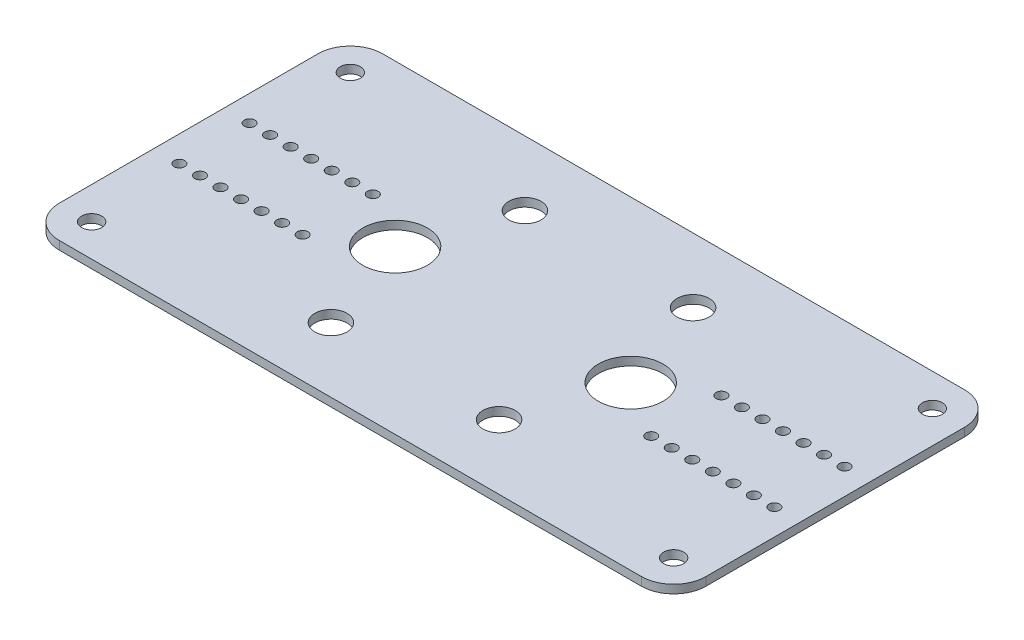
from build123d import *

# Parameters (mm, degrees)
SKETCH1_W               = 200
SKETCH1_H               = 100
BOSS_EXTRUDE1_DEPTH     = 2.6
FILLET1_R               = 10
SKETCH8_R               = 1.65
CUT_EXTRUDE4_DEPTH      = 2.6
LPATTERN1_COUNT         = 7
LPATTERN1_PITCH         = 6.35
MIRROR1_COPY_1_SKETCH_R = 1.65
MIRROR1_COPY_1_DEPTH    = 2.6
MIRROR1_COPY_2_SKETCH_R = 1.65
MIRROR1_COPY_2_DEPTH    = 2.6
MIRROR1_COPY_3_SKETCH_R = 1.65
MIRROR1_COPY_3_DEPTH    = 2.6
MIRROR1_COPY_4_SKETCH_R = 1.65
MIRROR1_COPY_4_DEPTH    = 2.6
MIRROR1_COPY_5_SKETCH_R = 1.65
MIRROR1_COPY_5_DEPTH    = 2.6
MIRROR1_COPY_6_SKETCH_R = 1.65
MIRROR1_COPY_6_DEPTH    = 2.6
SKETCH6_R               = 3.1
CUT_EXTRUDE6_DEPTH      = 2.6
MIRROR6_COPY_1_SKETCH_R = 3.1
MIRROR6_COPY_1_DEPTH    = 2.6
SKETCH13_R              = 4.980627928
CUT_EXTRUDE7_DEPTH      = 2.6
MIRROR8_COPY_1_SKETCH_R = 4.980627928
MIRROR8_COPY_1_DEPTH    = 2.6
SKETCH15_R              = 10
CUT_EXTRUDE8_DEPTH      = 2.6


with BuildPart() as part:
    # Sketch1 → Boss-Extrude1 (new body)
    with BuildSketch(Plane(origin=(0, 0, 0), x_dir=(1, 0, 0), z_dir=(0, 1, 0))):
        with Locations((100, -50)):
            Rectangle(SKETCH1_W, SKETCH1_H)
    extrude(amount=BOSS_EXTRUDE1_DEPTH)

    # Fillet1
    fillet1_edges = [part.edges().sort_by_distance(p)[0] for p in [
        (0, 1.3, 0),
        (200, 1.3, 0),
        (200, 1.3, 100),
        (0, 1.3, 100),
    ]]
    fillet(fillet1_edges, radius=FILLET1_R)

    # Sketch8 → Cut-Extrude4 (cut)
    with BuildSketch(Plane.XZ):
        with Locations(Location((192, 60.85, 0), (0, 0, 270))):
            Circle(SKETCH8_R)
        with Locations(Location((192, 39.15, 0), (0, 0, 270))):
            Circle(SKETCH8_R)
    cut_extrude4 = extrude(amount=-CUT_EXTRUDE4_DEPTH, mode=Mode.SUBTRACT)

    # LPattern1: Cut-Extrude4 ×7
    with Locations(*[(-i * LPATTERN1_PITCH, 0, 0) for i in range(1, LPATTERN1_COUNT)]):
        add(cut_extrude4, mode=Mode.SUBTRACT)

    # Mirror1: Cut-Extrude4 across plane
    add(cut_extrude4.mirror(Plane(origin=(100, 0, 0), x_dir=(0, 0, 1), z_dir=(1, 0, 0))), mode=Mode.SUBTRACT)

    # Mirror1 copy 1 sketch → Mirror1 copy 1 (cut)
    with BuildSketch(Plane(origin=(206.35, 0, 0), x_dir=(-1, 0, 0), z_dir=(0, -1, 0))):
        with Locations((192, -60.85)):
            Circle(MIRROR1_COPY_1_SKETCH_R)
        with Locations((192, -39.15)):
            Circle(MIRROR1_COPY_1_SKETCH_R)
    extrude(amount=-MIRROR1_COPY_1_DEPTH, mode=Mode.SUBTRACT)

    # Mirror1 copy 2 sketch → Mirror1 copy 2 (cut)
    with BuildSketch(Plane(origin=(212.7, 0, 0), x_dir=(-1, 0, 0), z_dir=(0, -1, 0))):
        with Locations((192, -60.85)):
            Circle(MIRROR1_COPY_2_SKETCH_R)
        with Locations((192, -39.15)):
            Circle(MIRROR1_COPY_2_SKETCH_R)
    extrude(amount=-MIRROR1_COPY_2_DEPTH, mode=Mode.SUBTRACT)

    # Mirror1 copy 3 sketch → Mirror1 copy 3 (cut)
    with BuildSketch(Plane(origin=(219.05, 0, 0), x_dir=(-1, 0, 0), z_dir=(0, -1, 0))):
        with Locations((192, -60.85)):
            Circle(MIRROR1_COPY_3_SKETCH_R)
        with Locations((192, -39.15)):
            Circle(MIRROR1_COPY_3_SKETCH_R)
    extrude(amount=-MIRROR1_COPY_3_DEPTH, mode=Mode.SUBTRACT)

    # Mirror1 copy 4 sketch → Mirror1 copy 4 (cut)
    with BuildSketch(Plane(origin=(225.4, 0, 0), x_dir=(-1, 0, 0), z_dir=(0, -1, 0))):
        with Locations((192, -60.85)):
            Circle(MIRROR1_COPY_4_SKETCH_R)
        with Locations((192, -39.15)):
            Circle(MIRROR1_COPY_4_SKETCH_R)
    extrude(amount=-MIRROR1_COPY_4_DEPTH, mode=Mode.SUBTRACT)

    # Mirror1 copy 5 sketch → Mirror1 copy 5 (cut)
    with BuildSketch(Plane(origin=(231.75, 0, 0), x_dir=(-1, 0, 0), z_dir=(0, -1, 0))):
        with Locations((192, -60.85)):
            Circle(MIRROR1_COPY_5_SKETCH_R)
        with Locations((192, -39.15)):
            Circle(MIRROR1_COPY_5_SKETCH_R)
    extrude(amount=-MIRROR1_COPY_5_DEPTH, mode=Mode.SUBTRACT)

    # Mirror1 copy 6 sketch → Mirror1 copy 6 (cut)
    with BuildSketch(Plane(origin=(238.1, 0, 0), x_dir=(-1, 0, 0), z_dir=(0, -1, 0))):
        with Locations((192, -60.85)):
            Circle(MIRROR1_COPY_6_SKETCH_R)
        with Locations((192, -39.15)):
            Circle(MIRROR1_COPY_6_SKETCH_R)
    extrude(amount=-MIRROR1_COPY_6_DEPTH, mode=Mode.SUBTRACT)

    # Sketch6 → Cut-Extrude6 (cut)
    with BuildSketch(Plane.XZ):
        with Locations(Location((190, 10, 0), (0, 0, 270))):
            Circle(SKETCH6_R)
    cut_extrude6 = extrude(amount=-CUT_EXTRUDE6_DEPTH, mode=Mode.SUBTRACT)

    # Mirror5: Cut-Extrude6 across plane
    add(cut_extrude6.mirror(Plane(origin=(100, 0, 0), x_dir=(0, 0, 1), z_dir=(1, 0, 0))), mode=Mode.SUBTRACT)

    # Mirror6: Cut-Extrude6 across plane
    add(cut_extrude6.mirror(Plane.XY.offset(50)), mode=Mode.SUBTRACT)

    # Mirror6 copy 1 sketch → Mirror6 copy 1 (cut)
    with BuildSketch(Plane(origin=(200, 0, 100), x_dir=(-1, 0, 0), z_dir=(0, -1, 0))):
        with Locations(Location((190, 10, 0), (0, 0, 270))):
            Circle(MIRROR6_COPY_1_SKETCH_R)
    extrude(amount=-MIRROR6_COPY_1_DEPTH, mode=Mode.SUBTRACT)

    # Sketch13 → Cut-Extrude7 (cut)
    with BuildSketch(Plane(origin=(0, 2.6, 0), x_dir=(1, 0, 0), z_dir=(0, 1, 0))):
        with Locations(Location((74, -80, 0), (0, 0, 270))):
            Circle(SKETCH13_R)
    cut_extrude7 = extrude(amount=-CUT_EXTRUDE7_DEPTH, mode=Mode.SUBTRACT)

    # Mirror7: Cut-Extrude7 across plane
    add(cut_extrude7.mirror(Plane.XY.offset(50)), mode=Mode.SUBTRACT)

    # Mirror8: Cut-Extrude7 across plane
    add(cut_extrude7.mirror(Plane(origin=(100, 0, 0), x_dir=(0, 0, 1), z_dir=(1, 0, 0))), mode=Mode.SUBTRACT)

    # Mirror8 copy 1 sketch → Mirror8 copy 1 (cut)
    with BuildSketch(Plane(origin=(200, 2.6, 100), x_dir=(-1, 0, 0), z_dir=(0, 1, 0))):
        with Locations(Location((74, -80, 0), (0, 0, 270))):
            Circle(MIRROR8_COPY_1_SKETCH_R)
    extrude(amount=-MIRROR8_COPY_1_DEPTH, mode=Mode.SUBTRACT)

    # Sketch15 → Cut-Extrude8 (cut)
    with BuildSketch(Plane.XZ):
        with Locations(Location((63.571852265, 49.722041857, 0), (0, 0, 270))):
            Circle(SKETCH15_R)
    cut_extrude8 = extrude(amount=-CUT_EXTRUDE8_DEPTH, mode=Mode.SUBTRACT)

    # Mirror9: Cut-Extrude8 across plane
    add(cut_extrude8.mirror(Plane(origin=(100, 0, 0), x_dir=(0, 0, 1), z_dir=(1, 0, 0))), mode=Mode.SUBTRACT)


solid = part.part
